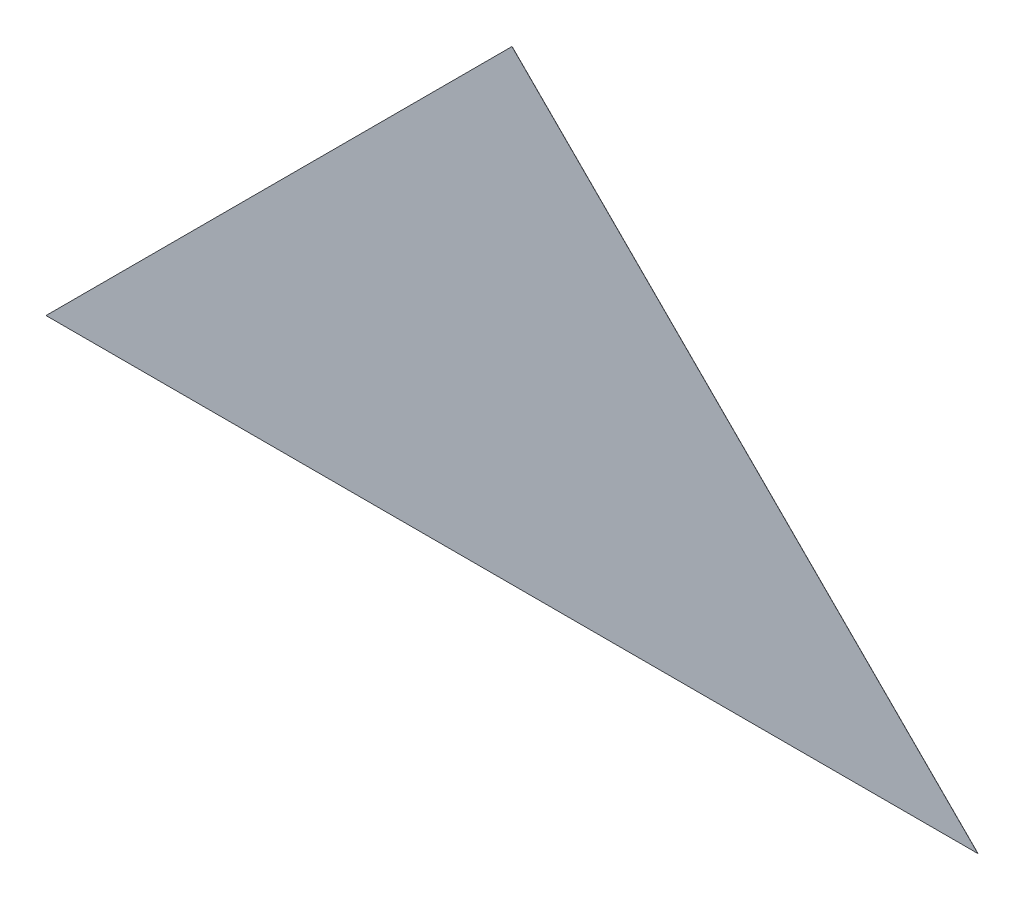
from build123d import *

# Parameters (mm, degrees)
BOSS_EXTRUDE1_DEPTH = 0.01


with BuildPart() as part:
    # Sketch1 → Boss-Extrude1 (new body)
    with BuildSketch(Plane.XY):
        Polygon((0, 0), (65, 0), (32.5, 32.5), align=None)
    extrude(amount=BOSS_EXTRUDE1_DEPTH)


solid = part.part
